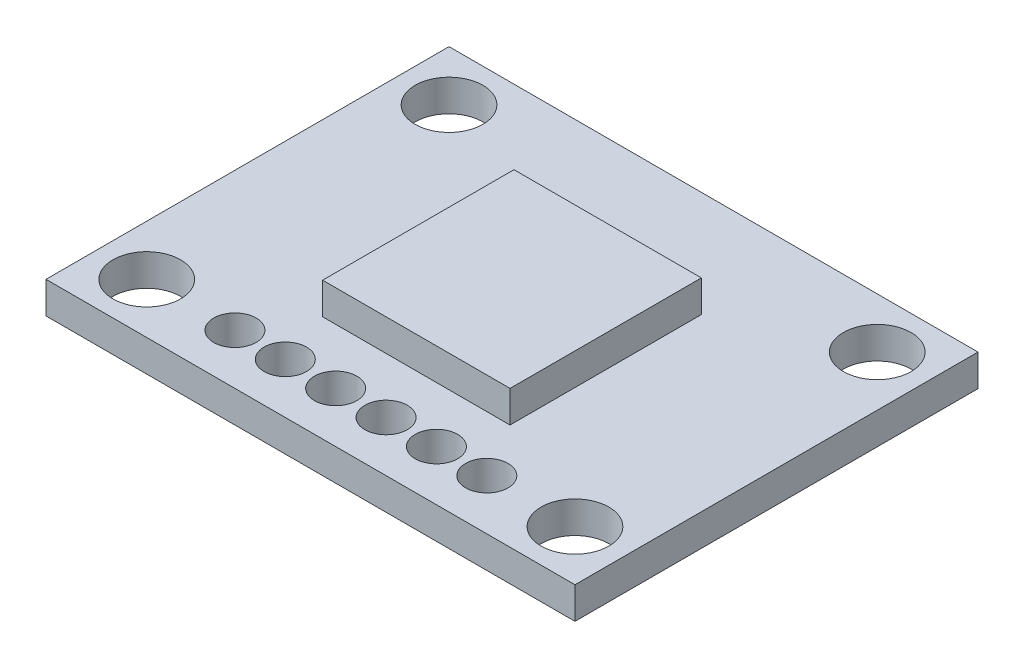
from build123d import *

# Parameters (mm, degrees)
SKETCH1_W           = 26.67
SKETCH1_H           = 20.32
SKETCH1_R           = 1.707818092
SKETCH1_R_2         = 1.06997981
BOSS_EXTRUDE1_DEPTH = 1.6
SKETCH2_W           = 9.449727346
SKETCH2_H           = 9.64726846
BOSS_EXTRUDE2_DEPTH = 1.6


with BuildPart() as part:
    # Sketch1 → Boss-Extrude1 (new body)
    with BuildSketch(Plane(origin=(0, 0, 0), x_dir=(1, 0, 0), z_dir=(0, 1, 0))):
        Rectangle(SKETCH1_W, SKETCH1_H)
        with Locations(Location((-10.795, 7.62, 0), (0, 0, 270))):
            Circle(SKETCH1_R, mode=Mode.SUBTRACT)
        with Locations(Location((10.795, 7.62, 0), (0, 0, 90))):
            Circle(SKETCH1_R, mode=Mode.SUBTRACT)
        with Locations(Location((10.795, -7.62, 0), (0, 0, 270))):
            Circle(SKETCH1_R, mode=Mode.SUBTRACT)
        with Locations(Location((-10.795, -7.62, 0), (0, 0, 90))):
            Circle(SKETCH1_R, mode=Mode.SUBTRACT)
        with Locations(Location((-1.27, -7.62, 0), (0, 0, 270))):
            Circle(SKETCH1_R_2, mode=Mode.SUBTRACT)
        with Locations(Location((-3.81, -7.62, 0), (0, 0, 270))):
            Circle(SKETCH1_R_2, mode=Mode.SUBTRACT)
        with Locations(Location((-6.35, -7.62, 0), (0, 0, 270))):
            Circle(SKETCH1_R_2, mode=Mode.SUBTRACT)
        with Locations(Location((6.35, -7.62, 0), (0, 0, 90))):
            Circle(SKETCH1_R_2, mode=Mode.SUBTRACT)
        with Locations(Location((3.81, -7.62, 0), (0, 0, 90))):
            Circle(SKETCH1_R_2, mode=Mode.SUBTRACT)
        with Locations(Location((1.27, -7.62, 0), (0, 0, 90))):
            Circle(SKETCH1_R_2, mode=Mode.SUBTRACT)
    extrude(amount=BOSS_EXTRUDE1_DEPTH)

    # Sketch2 → Boss-Extrude2 (add)
    with BuildSketch(Plane(origin=(0, 1.6, 0), x_dir=(1, 0, 0), z_dir=(0, 1, 0))):
        Rectangle(SKETCH2_W, SKETCH2_H)
    extrude(amount=BOSS_EXTRUDE2_DEPTH)


solid = part.part
